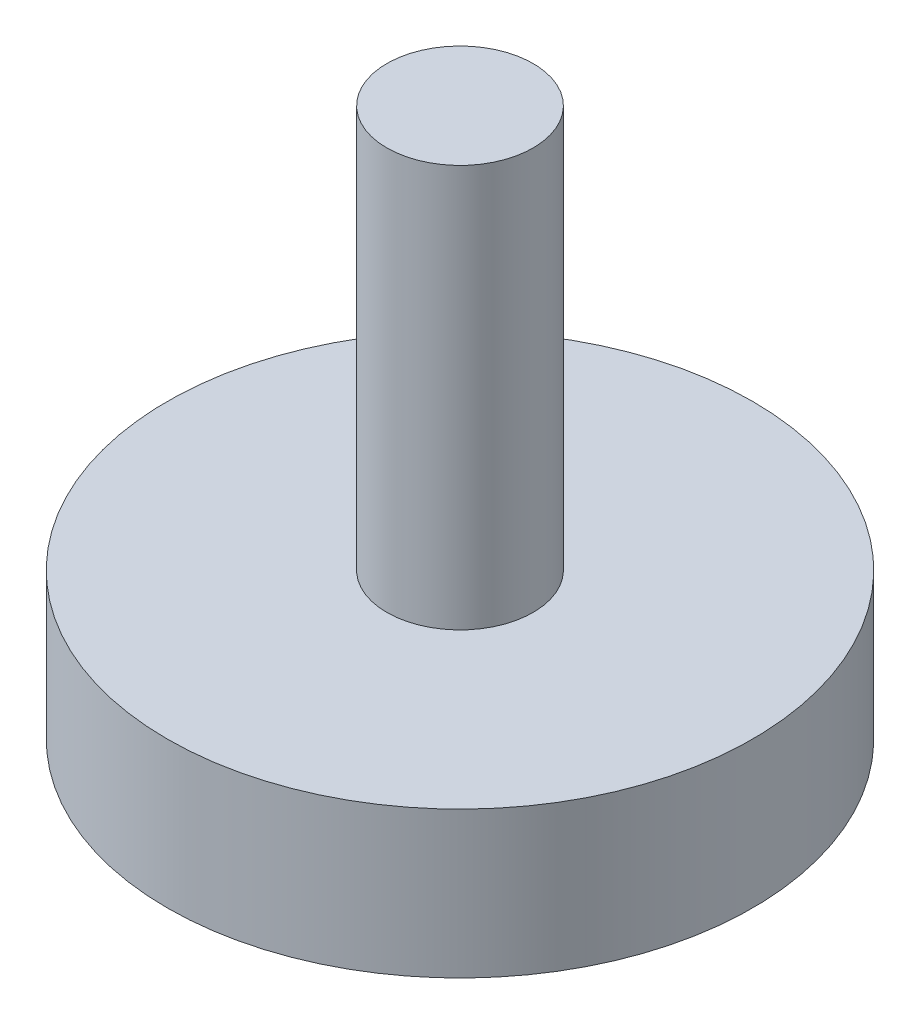
from build123d import *

# Parameters (mm, degrees)
SKETCH_1_R      = 40
EXTRUDE_1_DEPTH = 20
SKETCH_2_R      = 10
EXTRUDE_2_DEPTH = 55


with BuildPart() as part:
    # 草图1 → 凸台-拉伸1 (new body)
    with BuildSketch(Plane(origin=(0, 0, 0), x_dir=(1, 0, 0), z_dir=(0, 1, 0))):
        with Locations(Location((0, 0, 0), (0, 0, 270))):
            Circle(SKETCH_1_R)
    extrude(amount=EXTRUDE_1_DEPTH)

    # 草图2 → 凸台-拉伸2 (add)
    with BuildSketch(Plane(origin=(0, 20, 0), x_dir=(1, 0, 0), z_dir=(0, 1, 0))):
        with Locations(Location((0, 0, 0), (0, 0, 270))):
            Circle(SKETCH_2_R)
    extrude(amount=EXTRUDE_2_DEPTH)


solid = part.part
